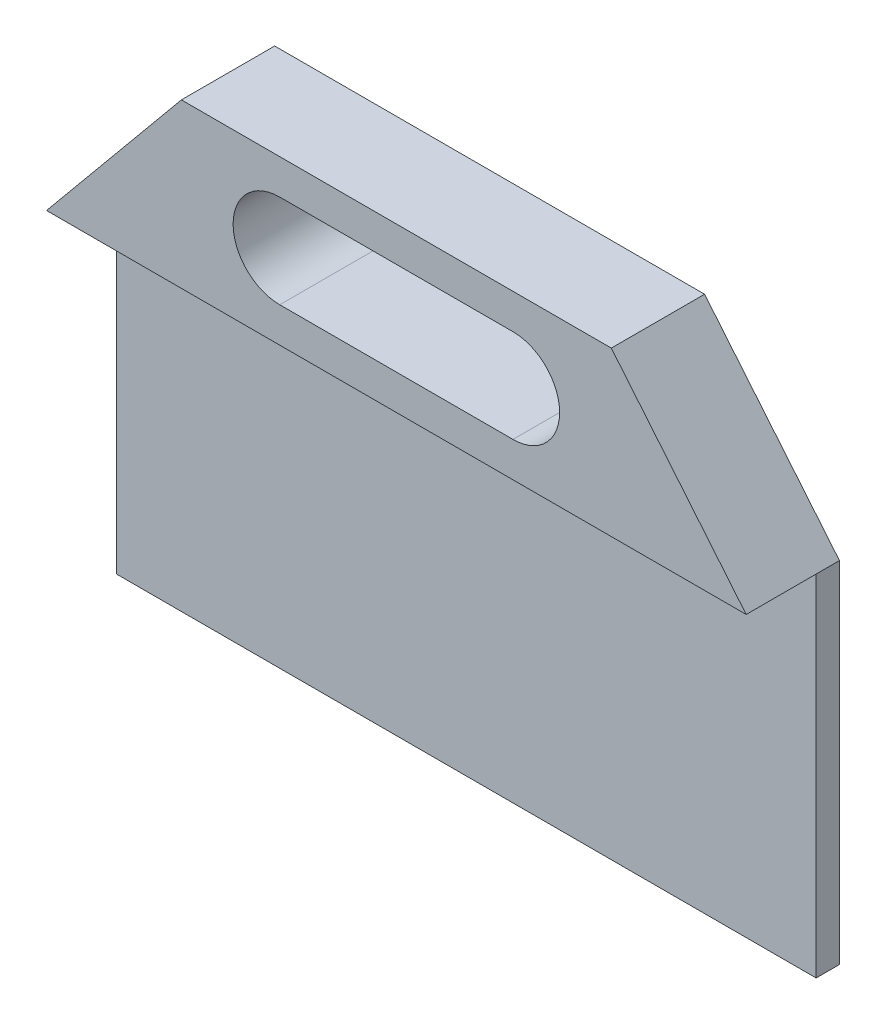
from build123d import *

# Parameters (mm, degrees)
SKETCH_1_W      = 30
SKETCH_1_H      = 15
EXTRUDE_1_DEPTH = 1
EXTRUDE_2_DEPTH = 4


with BuildPart() as part:
    # 草图1 → 凸台-拉伸1 (new body)
    with BuildSketch(Plane.XY):
        Rectangle(SKETCH_1_W, SKETCH_1_H)
    extrude(amount=EXTRUDE_1_DEPTH)

    # 草图1<3> → 凸台-拉伸2 (add)
    with BuildSketch(Plane.XY):
        Polygon((-9.217262909, 14.5), (-15, 7.5), (15, 7.5), (9.217262909, 14.5), align=None)
        with BuildLine():
            ThreePointArc((-5, 9), (-7, 11), (-5, 13))
            Line((-5, 13), (5, 13))
            ThreePointArc((5, 13), (7, 11), (5, 9))
            Line((5, 9), (-5, 9))
        make_face(mode=Mode.SUBTRACT)
    extrude(amount=EXTRUDE_2_DEPTH)


solid = part.part
